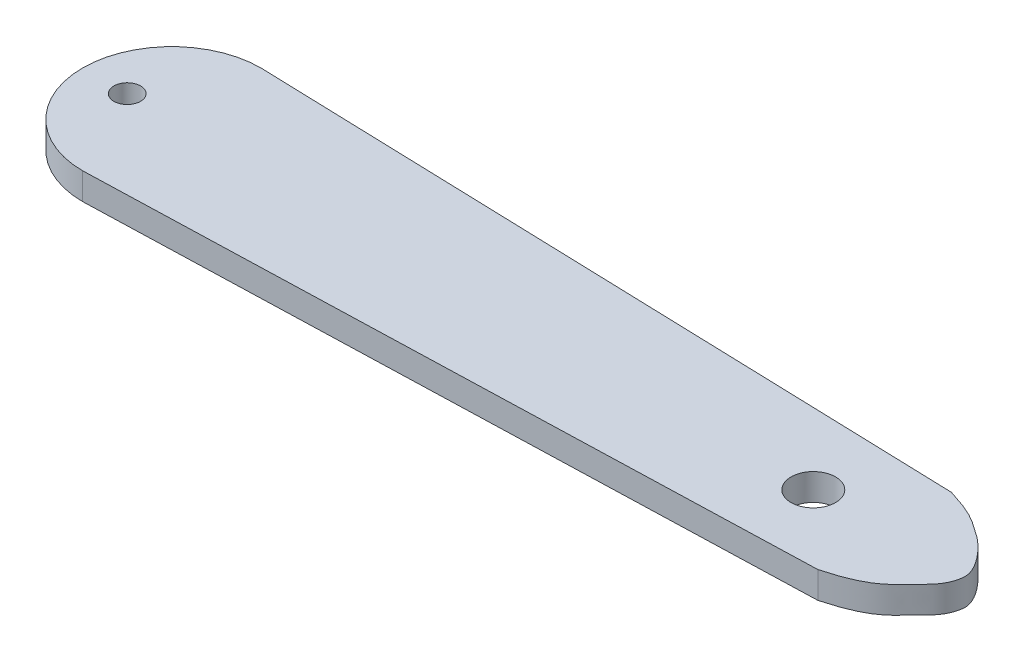
from build123d import *

# Parameters (mm, degrees)
ESTRUSIONE_ESTRUSIONE1_DEPTH = 3
SCHIZZO2_R                   = 2.5
SCHIZZO2_R_2                 = 1.5
TAGLIO_ESTRUSIONE1_DEPTH     = 4


with BuildPart() as part:
    # Schizzo1 → Estrusione-Estrusione1 (new body)
    with BuildSketch(Plane(origin=(0, 0, 0), x_dir=(1, 0, 0), z_dir=(0, 1, 0))):
        with BuildLine():
            Line((-50, 10), (30, 7.5))
            add(Edge.make_bspline(
                [(30, 7.5), (33.261716858, 6.481496625), (33.844483216, 5.888387677), (36.662246593, 4.013349049), (39.160928363, 1.186216806), (38.675315874, -1.975639526), (37.390186483, -2.924572182), (35.347677145, -5.108790593), (33.432549191, -6.590635505), (30, -7.5)],
                knots=[0, 0, 0, 0, 0.303835535, 0.360141123, 0.540509801, 0.596736192, 0.866178642, 0.909873054, 1, 1, 1, 1], degree=3))
            Line((30, -7.5), (-50, -10))
            ThreePointArc((-50, -10), (-60, 0), (-50, 10))
        make_face()
    extrude(amount=ESTRUSIONE_ESTRUSIONE1_DEPTH)

    # Schizzo2 → Taglio-Estrusione1 (cut)
    with BuildSketch(Plane(origin=(0, 3, 0), x_dir=(1, 0, 0), z_dir=(0, 1, 0))):
        with Locations(Location((22, 0, 0), (0, 0, 270))):
            Circle(SCHIZZO2_R)
        with Locations(Location((-55, 0, 0), (0, 0, 270))):
            Circle(SCHIZZO2_R_2)
    extrude(amount=-TAGLIO_ESTRUSIONE1_DEPTH, mode=Mode.SUBTRACT)


solid = part.part
